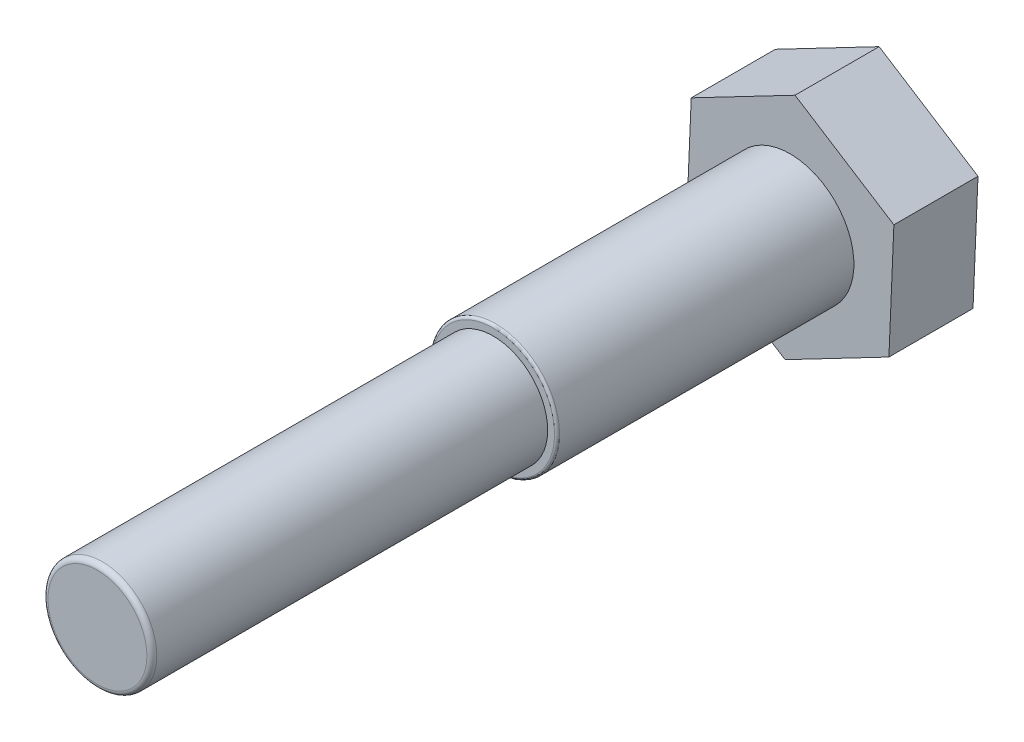
from build123d import *

# Parameters (mm, degrees)
EXTRUDE_302_DEPTH = 17
SKETCH_2_R        = 12.9
EXTRUDE_1_DEPTH   = 60
SKETCH_3_R        = 11
EXTRUDE_2_DEPTH   = 80
FILLET_2_R        = 1
FILLET_4_R        = 0.5


with BuildPart() as part:
    # 草图1 → Extrude 302 (new body)
    with BuildSketch(Plane.XY):
        Polygon((20.984201837, 10.954296262), (1.005402075, 23.65), (-19.978799762, 12.695703738), (-20.984201837, -10.954296262), (-1.005402075, -23.65), (19.978799762, -12.695703738), align=None)
    extrude(amount=EXTRUDE_302_DEPTH)

    # 草图2 → 凸台-拉伸1 (add)
    with BuildSketch(Plane.XY.offset(17)):
        with Locations(Location((0, 0, 0), (0, 0, 180))):
            Circle(SKETCH_2_R)
    extrude(amount=EXTRUDE_1_DEPTH)

    # 草图3 → 凸台-拉伸2 (add)
    with BuildSketch(Plane.XY.offset(77)):
        Circle(SKETCH_3_R)
    extrude(amount=EXTRUDE_2_DEPTH)

    # 圆角2
    fillet_2_edges = [part.edges().sort_by_distance(p)[0] for p in [
        (-11, 0, 157),
    ]]
    fillet(fillet_2_edges, radius=FILLET_2_R)

    # 圆角4
    fillet_4_edges = [part.edges().sort_by_distance(p)[0] for p in [
        (12.9, 0, 77),
    ]]
    fillet(fillet_4_edges, radius=FILLET_4_R)


solid = part.part
